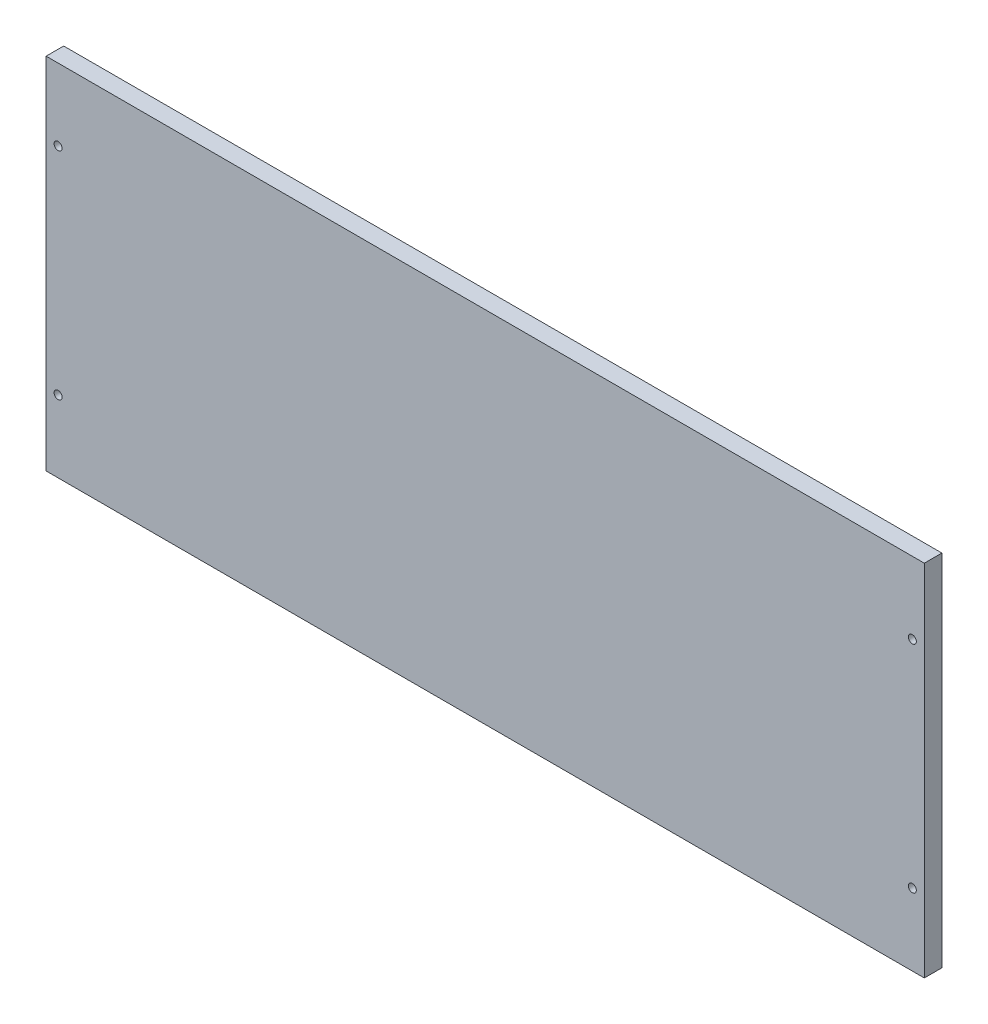
from build123d import *

# Parameters (mm, degrees)
ESQUISSE1_W          = 1100
ESQUISSE1_H          = 450
BOSS_EXTRU_1_DEPTH   = 22
D_GAGEMENT_M81_D     = 10
D_GAGEMENT_M81_DEPTH = 120
D_GAGEMENT_M81_TIP   = 3.004303095


with BuildPart() as part:
    # Esquisse1 → Boss.-Extru.1 (new body)
    with BuildSketch(Plane.XY):
        Rectangle(ESQUISSE1_W, ESQUISSE1_H)
    extrude(amount=BOSS_EXTRU_1_DEPTH)

    # Dégagement M81
    with Locations(Plane(origin=(360, -240, -30), x_dir=(-1, 0, 0), z_dir=(0, 0, -1))):
        with Locations((895, 375), (895, 105), (-175, 375), (-175, 105)):
            Hole(D_GAGEMENT_M81_D / 2, depth=D_GAGEMENT_M81_DEPTH)
            with Locations((0, 0, -(D_GAGEMENT_M81_DEPTH + D_GAGEMENT_M81_TIP / 2))):  # 118° drill point
                Cone(0, D_GAGEMENT_M81_D / 2, D_GAGEMENT_M81_TIP, mode=Mode.SUBTRACT)


solid = part.part
